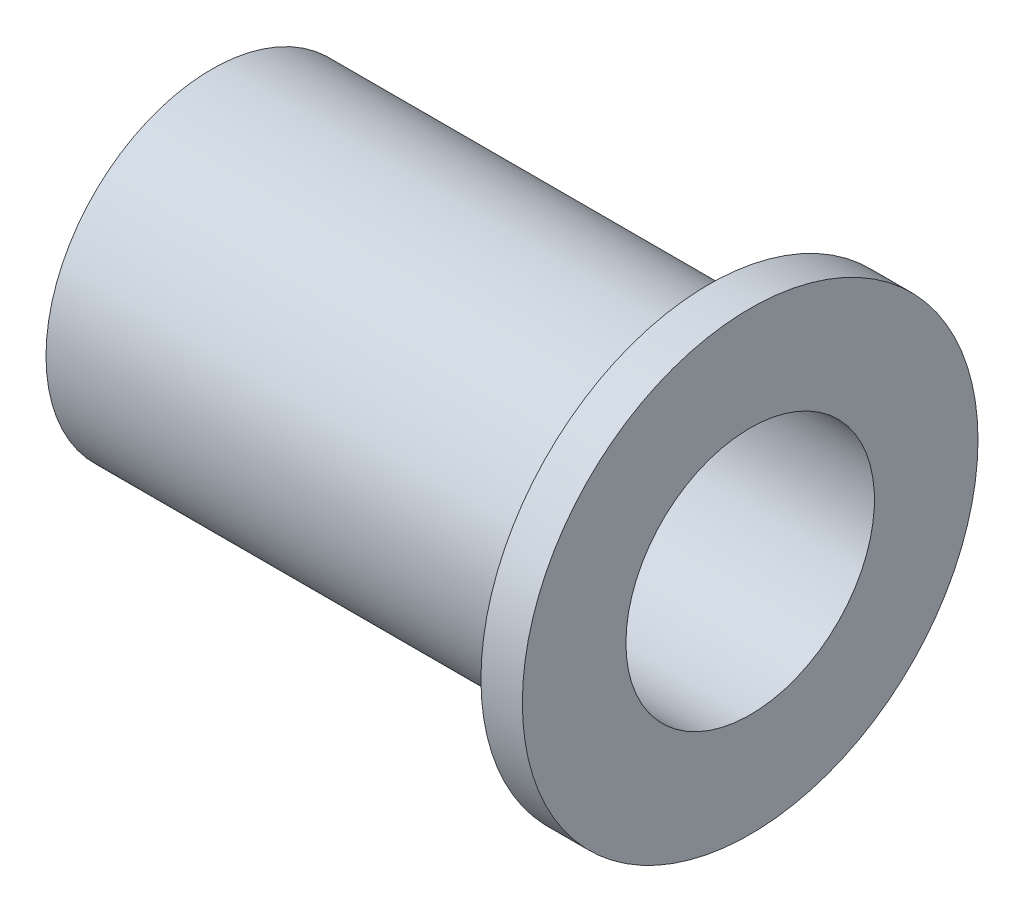
from build123d import *


with BuildPart() as part:
    # Sketch1 → Revolve1 (revolve)
    with BuildSketch(Plane(origin=(0, 0, 0), x_dir=(1, 0, 0), z_dir=(0, 1, 0)), mode=Mode.PRIVATE) as revolve1_sk:
        Polygon((0, 4.7625), (0, 6.35), (19.05, 6.35), (19.05, 8.73125), (20.6375, 8.73125), (20.6375, 4.7625), align=None)
    revolve(revolve1_sk.sketch.rotate(Axis((0, 0, 0), (1, 0, 0)), 180), axis=Axis((0, 0, 0), (1, 0, 0)))


solid = part.part
